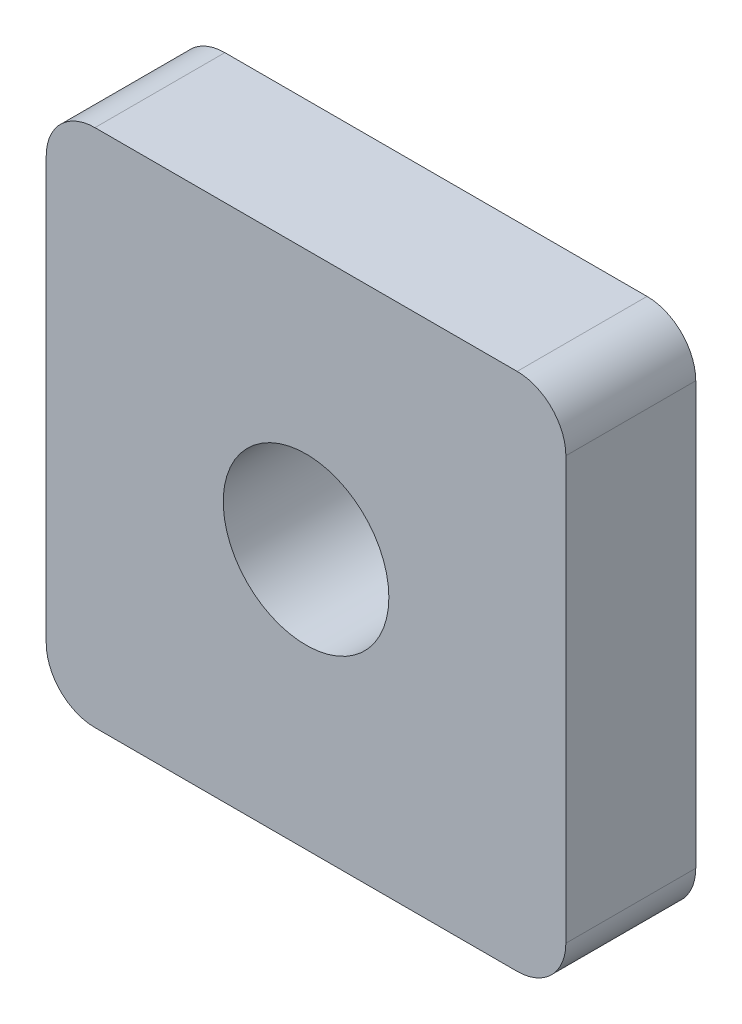
from build123d import *

# Parameters (mm, degrees)
SKETCH_1_W          = 32
SKETCH_1_H          = 32
EXTRUDE_1_DEPTH     = 8
SKETCH_2_R          = 5.1
CUT_EXTRUDE_1_DEPTH = 25
FILLET_1_R          = 3


with BuildPart() as part:
    # Эскиз1 → Бобышка-Вытянуть1 (new body)
    with BuildSketch(Plane.XY):
        Rectangle(SKETCH_1_W, SKETCH_1_H)
    extrude(amount=EXTRUDE_1_DEPTH)

    # Эскиз2 → Вырез-Вытянуть1 (cut, through all)
    with BuildSketch(Plane.XY.offset(8)):
        Circle(SKETCH_2_R)
    extrude(amount=-CUT_EXTRUDE_1_DEPTH, mode=Mode.SUBTRACT)

    # Скругление1
    fillet_1_edges = [part.edges().sort_by_distance(p)[0] for p in [
        (16, -16, 4),
        (-16, -16, 4),
        (-16, 16, 4),
        (16, 16, 4),
    ]]
    fillet(fillet_1_edges, radius=FILLET_1_R)


solid = part.part
